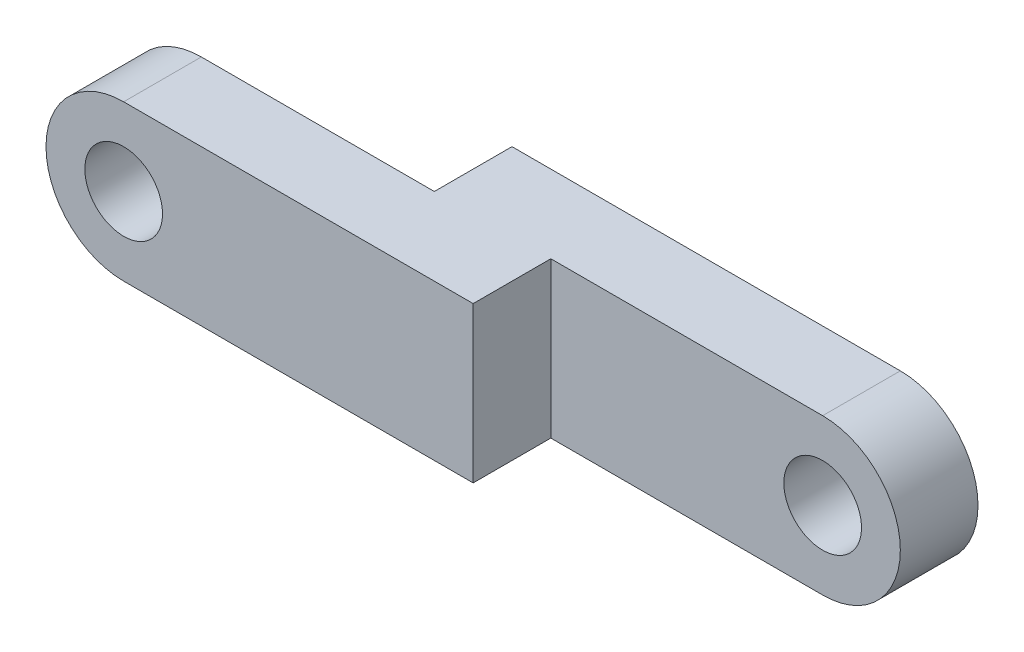
from build123d import *
from build123d.topology import SkipClean

# Parameters (mm, degrees)
BOSS_EXTRUDE1_DEPTH      = 1.27
BOSS_EXTRUDE1_DEPTH_BACK = 1.27
SKETCH1_R                = 1.27
BOSS_EXTRUDE2_START      = 2.54
SKETCH3_R                = 1.27
BOSS_EXTRUDE2_DEPTH      = 2.54
SKETCH4_W                = 11.43
SKETCH4_H                = 2.54
CUT_EXTRUDE2_DEPTH       = 15.199031657


with BuildPart() as part:
    # Sketch1 → Boss-Extrude1 (new, two sides: drawn at the far end of the back side and taken through both)
    with BuildSketch(Plane.XY.offset(-BOSS_EXTRUDE1_DEPTH_BACK)):
        with BuildLine():
            Line((-10.16, 2.54), (10.16, 2.54))
            ThreePointArc((10.16, 2.54), (12.7, 0), (10.16, -2.54))
            Line((10.16, -2.54), (-10.16, -2.54))
            ThreePointArc((-10.16, -2.54), (-12.7, 0), (-10.16, 2.54))
        make_face()
        with Locations((-10.16, 0)):
            Circle(SKETCH1_R, mode=Mode.SUBTRACT)
        with Locations((10.16, 0)):
            Circle(SKETCH1_R, mode=Mode.SUBTRACT)
    extrude(amount=BOSS_EXTRUDE1_DEPTH + BOSS_EXTRUDE1_DEPTH_BACK)

    # Sketch3 → Boss-Extrude2 (add)
    with SkipClean():  # the faces are left unmerged after this step: merging them gives an invalid solid
        with BuildSketch(Plane(origin=(0, 0, -1.27), x_dir=(-1, 0, 0), z_dir=(0, 0, -1)).offset(BOSS_EXTRUDE2_START)):
            with BuildLine():
                Line((2.54, -2.54), (2.54, 2.54))
                Line((2.54, 2.54), (-10.16, 2.54))
                ThreePointArc((-10.16, 2.54), (-12.7, 0), (-10.16, -2.54))
                Line((-10.16, -2.54), (2.54, -2.54))
            make_face()
            with Locations((-10.16, 0)):
                Circle(SKETCH3_R, mode=Mode.SUBTRACT)
        extrude(amount=-BOSS_EXTRUDE2_DEPTH)

    # Sketch4 → Cut-Extrude2 (cut, through all)
    with BuildSketch(Plane(origin=(0, 2.54, 0), x_dir=(1, 0, 0), z_dir=(0, 1, 0))):
        with Locations((6.985, 0)):
            Rectangle(SKETCH4_W, SKETCH4_H)
    extrude(amount=-CUT_EXTRUDE2_DEPTH, mode=Mode.SUBTRACT)


solid = part.part
